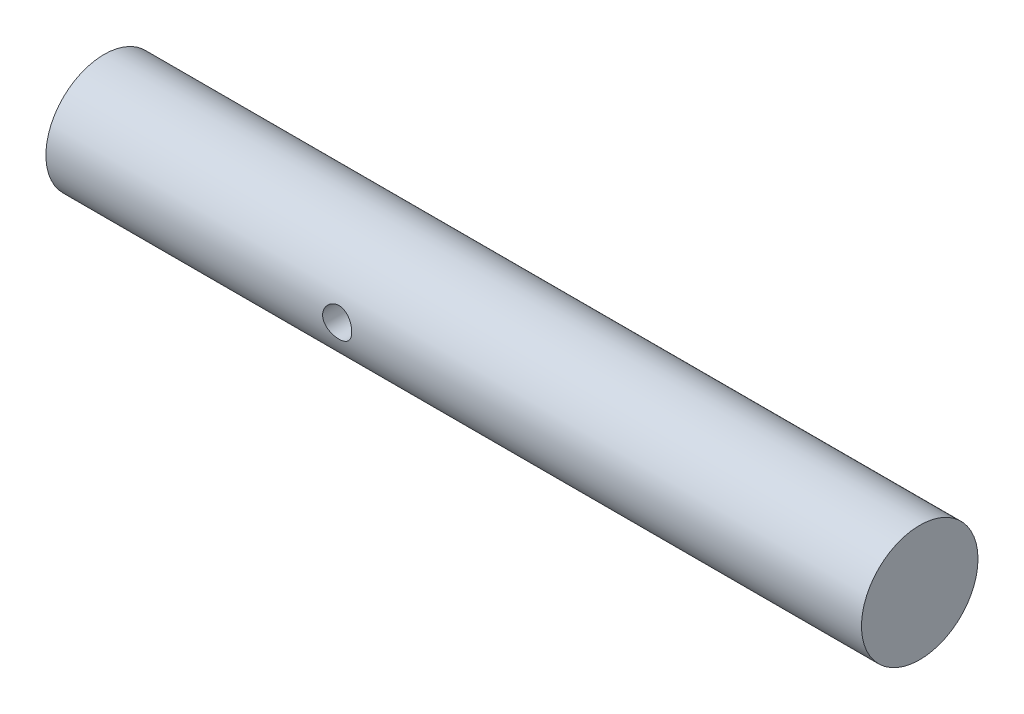
from build123d import *

# Parameters (mm, degrees)
SWEEP1_PROFILE_R   = 12.7
SKETCH18_R         = 3.175
CUT_EXTRUDE1_DEPTH = 179.704840449
LPATTERN1_COUNT    = 4
LPATTERN1_PITCH    = 25.4
SKETCH19_R         = 3.175
CUT_EXTRUDE2_DEPTH = 179.704840563


with BuildPart() as part:
    # Sweep1: sweep along a path in Sketch1
    with BuildLine(Plane.XY) as sweep1_path:
        Line((0, 0), (177.8, 0))
    # Sweep1 profile (on start of the path) → Sweep1 (sweep)
    with BuildSketch(Plane(origin=(0, 0, 0), x_dir=(0, 0, 1), z_dir=(1, 0, 0))):
        Circle(SWEEP1_PROFILE_R)
    sweep(path=sweep1_path.line)

    # Sketch18 → Cut-Extrude1 (cut, through all)
    with BuildSketch(Plane.XY):
        with Locations((139.7, 0)):
            Circle(SKETCH18_R)
    cut_extrude1 = extrude(amount=-CUT_EXTRUDE1_DEPTH, mode=Mode.SUBTRACT)

    # LPattern1: Cut-Extrude1 ×4
    with Locations(*[(-i * LPATTERN1_PITCH, 0, 0) for i in range(1, LPATTERN1_COUNT)]):
        add(cut_extrude1, mode=Mode.SUBTRACT)

    # Sketch19 → Cut-Extrude2 (cut, through all)
    with BuildSketch(Plane(origin=(0, 0, 0), x_dir=(-1, 0, 0), z_dir=(0, 0, -1))):
        with Locations((-63.5, 0)):
            Circle(SKETCH19_R)
    extrude(amount=-CUT_EXTRUDE2_DEPTH, mode=Mode.SUBTRACT)


solid = part.part
